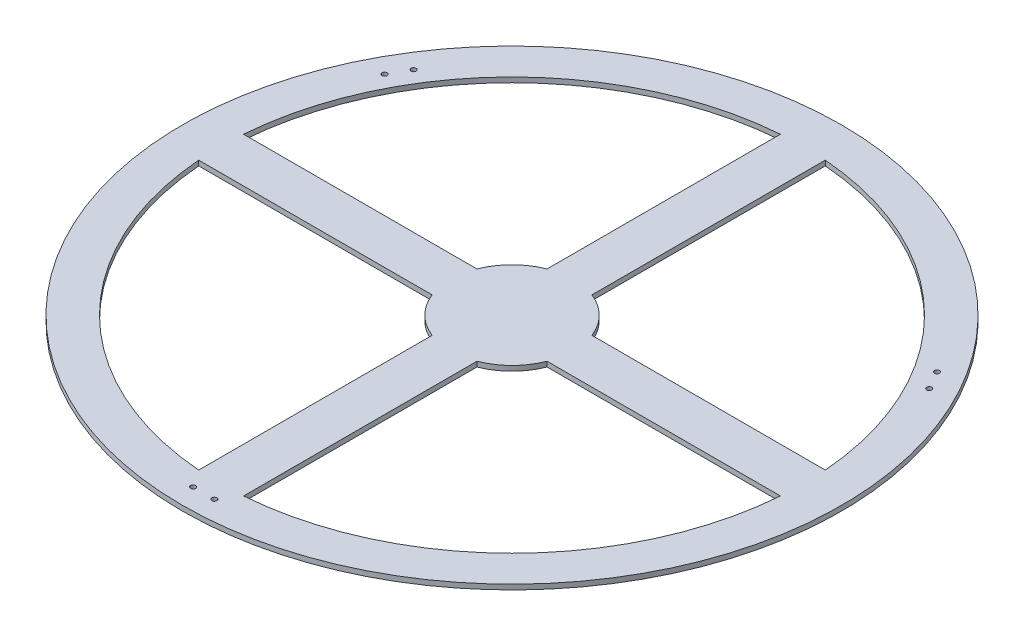
from build123d import *

# Parameters (mm, degrees)
SKETCH1_R           = 196.85
SKETCH1_R_2         = 1.5
BOSS_EXTRUDE1_DEPTH = 3


with BuildPart() as part:
    # Sketch1 → Boss-Extrude1 (new body)
    with BuildSketch(Plane(origin=(0, 0, 0), x_dir=(1, 0, 0), z_dir=(0, 1, 0))):
        with Locations(Location((479.721156758, 531.943650225, 0), (0, 0, 270))):
            Circle(SKETCH1_R)
        with Locations(Location((473.371156758, 347.793650225, 0), (0, 0, 270))):
            Circle(SKETCH1_R_2, mode=Mode.SUBTRACT)
        with Locations(Location((486.071156758, 347.793650225, 0), (0, 0, 270))):
            Circle(SKETCH1_R_2, mode=Mode.SUBTRACT)
        with Locations(Location((323.417578651, 629.517911539, 0), (0, 0, 270))):
            Circle(SKETCH1_R_2, mode=Mode.SUBTRACT)
        with Locations(Location((317.067578651, 618.519388911, 0), (0, 0, 270))):
            Circle(SKETCH1_R_2, mode=Mode.SUBTRACT)
        with Locations(Location((642.374734865, 618.519388911, 0), (0, 0, 270))):
            Circle(SKETCH1_R_2, mode=Mode.SUBTRACT)
        with Locations(Location((636.024734865, 629.517911539, 0), (0, 0, 270))):
            Circle(SKETCH1_R_2, mode=Mode.SUBTRACT)
        with BuildLine():
            Line((653.442357833, 518.540768582), (514.055823837, 518.540768582))
            ThreePointArc((514.055823837, 518.540768582), (505.783645125, 505.881161858), (493.124038401, 497.608983146))
            Line((493.124038401, 497.608983146), (493.124038401, 358.22244915))
            ThreePointArc((493.124038401, 358.22244915), (602.925647219, 408.739159764), (653.442357833, 518.540768582))
        make_face(mode=Mode.SUBTRACT)
        with BuildLine():
            Line((305.999955683, 518.540768582), (445.386489679, 518.540768582))
            ThreePointArc((445.386489679, 518.540768582), (453.658668391, 505.881161858), (466.318275115, 497.608983146))
            Line((466.318275115, 497.608983146), (466.318275115, 358.22244915))
            ThreePointArc((466.318275115, 358.22244915), (356.516666298, 408.739159764), (305.999955683, 518.540768582))
        make_face(mode=Mode.SUBTRACT)
        with BuildLine():
            Line((653.442357833, 545.346531867), (514.055823837, 545.346531867))
            ThreePointArc((514.055823837, 545.346531867), (505.783645125, 558.006138591), (493.124038401, 566.278317303))
            Line((493.124038401, 566.278317303), (493.124038401, 705.6648513))
            ThreePointArc((493.124038401, 705.6648513), (602.925647219, 655.148140685), (653.442357833, 545.346531867))
        make_face(mode=Mode.SUBTRACT)
        with BuildLine():
            Line((445.386489679, 545.346531867), (305.999955683, 545.346531867))
            ThreePointArc((305.999955683, 545.346531867), (356.516666298, 655.148140685), (466.318275115, 705.6648513))
            Line((466.318275115, 705.6648513), (466.318275115, 566.278317303))
            ThreePointArc((466.318275115, 566.278317303), (453.658668391, 558.006138591), (445.386489679, 545.346531867))
        make_face(mode=Mode.SUBTRACT)
    extrude(amount=BOSS_EXTRUDE1_DEPTH)


solid = part.part
